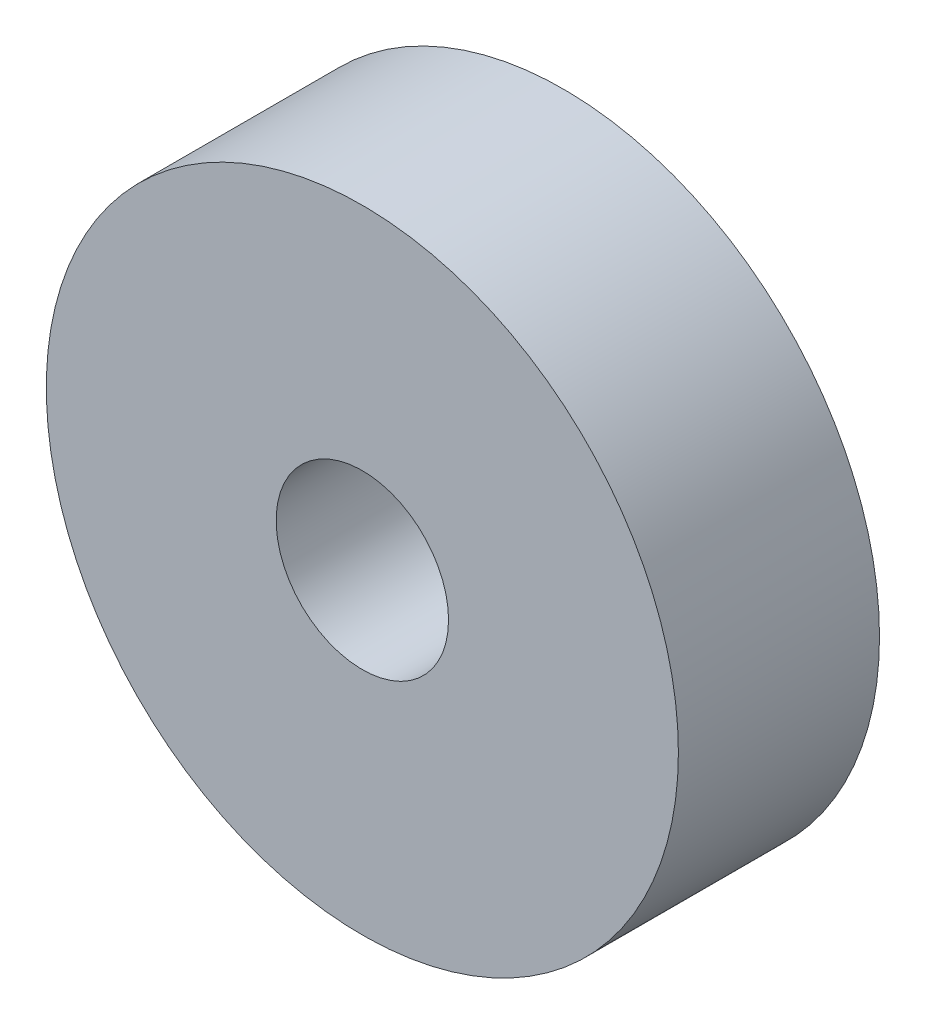
from build123d import *

# Parameters (mm, degrees)
SKETCH_1_R      = 11
SKETCH_1_R_2    = 3
EXTRUDE_1_DEPTH = 7


with BuildPart() as part:
    # 草图1 → 凸台-拉伸1 (new body)
    with BuildSketch(Plane.XY):
        Circle(SKETCH_1_R)
        Circle(SKETCH_1_R_2, mode=Mode.SUBTRACT)
    extrude(amount=EXTRUDE_1_DEPTH)


solid = part.part
